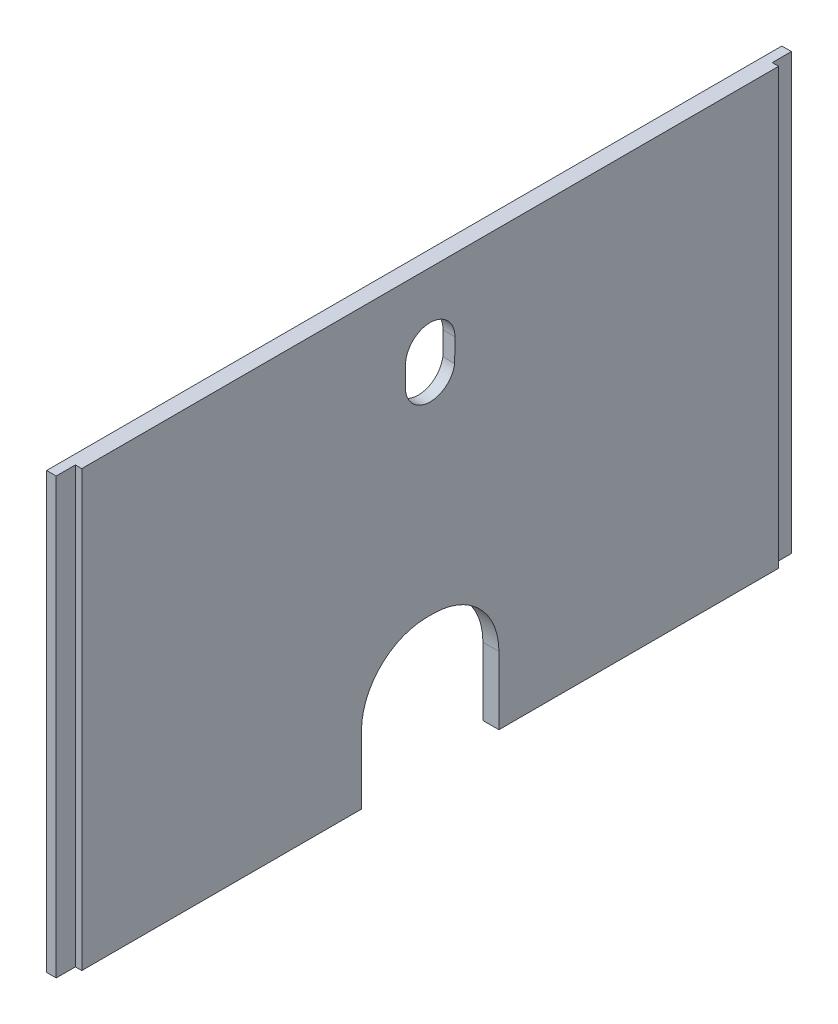
from build123d import *

# Parameters (mm, degrees)
SKETCH_1_W           = 120
SKETCH_1_H           = 68
EXTRUDE_1_DEPTH      = 3
CUT_EXTRUDE_1_DEPTH  = 91.735880444
CUT_EXTRUDE_7_DEPTH  = 2.5
CUT_EXTRUDE_10_DEPTH = 2.5
SKETCH_17_W          = 9
SKETCH_17_H          = 12
CUT_EXTRUDE_11_DEPTH = 0.65
EXTRUDE_2_DEPTH      = 8
SKETCH_19_W          = 1.564505321
SKETCH_19_H          = 29.5
CUT_EXTRUDE_12_DEPTH = 8
EXTRUDE_3_DEPTH      = 3


with BuildPart() as part:
    # 스케치1 → 보스-돌출1 (new body)
    with BuildSketch(Plane(origin=(0, 0, 0), x_dir=(0, 0, -1), z_dir=(1, 0, 0))):
        Rectangle(SKETCH_1_W, SKETCH_1_H)
    extrude(amount=EXTRUDE_1_DEPTH)

    # 스케치2 → 컷-돌출1 (cut, through all)
    with BuildSketch(Plane(origin=(0, 34, 0), x_dir=(1, 0, 0), z_dir=(0, 1, 0))):
        Polygon((0.5, -60), (0.5, -57.5), (0.5, 0), (0, 0), (0, -60), align=None)
        Polygon((2, -57.5), (0.5, -57.5), (0.5, -60), (3, -60), (3, -54.5), (2, -54.5), align=None)
        Polygon((0.5, 60), (0.5, 57.5), (2, 57.5), (2, 54.5), (3, 54.5), (3, 60), align=None)
        Polygon((0, 0), (0.5, 0), (0.5, 57.5), (0.5, 60), (0, 60), align=None)
    extrude(amount=-CUT_EXTRUDE_1_DEPTH, mode=Mode.SUBTRACT)

    # 스케치7 → 컷-돌출7 (cut)
    with BuildSketch(Plane(origin=(3, 0, 0), x_dir=(0, 0, -1), z_dir=(1, 0, 0))):
        with BuildLine():
            Line((0.5, -13.133811576), (-0.5, -13.133811576))
            ThreePointArc((-0.5, -13.133811576), (-7.747844507, -16.135967068), (-10.75, -23.383811576))
            Line((-10.75, -23.383811576), (-10.75, -34))
            Line((-10.75, -34), (10.75, -34))
            Line((10.75, -34), (10.75, -23.383811576))
            ThreePointArc((10.75, -23.383811576), (7.747844507, -16.135967068), (0.5, -13.133811576))
        make_face()
    extrude(amount=-CUT_EXTRUDE_7_DEPTH, mode=Mode.SUBTRACT)

    # 스케치16 → 컷-돌출10 (cut)
    with BuildSketch(Plane(origin=(3, 0, 0), x_dir=(0, 0, -1), z_dir=(1, 0, 0))):
        with BuildLine():
            Line((-3.875, 22.666188424), (-3.82691794, 19.057645835))
            ThreePointArc((-3.82691794, 19.057645835), (0, 15.791188424), (3.82691794, 19.057645835))
            Line((3.82691794, 19.057645835), (3.875, 22.666188424))
            ThreePointArc((3.875, 22.666188424), (0, 26.541188424), (-3.875, 22.666188424))
        make_face()
    extrude(amount=-CUT_EXTRUDE_10_DEPTH, mode=Mode.SUBTRACT)

    # 스케치17 → 컷-돌출11 (cut)
    with BuildSketch(Plane.ZY.offset(-0.5)):
        with Locations((0, 20.55)):
            Rectangle(SKETCH_17_W, SKETCH_17_H)
    extrude(amount=-CUT_EXTRUDE_11_DEPTH, mode=Mode.SUBTRACT)

    # 스케치18 → 보스-돌출2 (add)
    with BuildSketch(Plane.ZY.offset(-0.5)):
        Polygon((-12.5, 4.5), (-14.75, 4.5), (-14.75, 2.5), (0, 2.5), (0, 4.5), align=None)
        Polygon((12.5, 4.5), (0, 4.5), (0, 2.5), (14.75, 2.5), (14.75, 4.5), align=None)
    extrude(amount=EXTRUDE_2_DEPTH)

    # 스케치19 → 컷-돌출12 (cut)
    with BuildSketch(Plane(origin=(0, 4.5, 0), x_dir=(1, 0, 0), z_dir=(0, 1, 0))):
        with Locations((-6.71774734, 0)):
            Rectangle(SKETCH_19_W, SKETCH_19_H)
    extrude(amount=-CUT_EXTRUDE_12_DEPTH, mode=Mode.SUBTRACT)

    # 스케치19<3> → 보스-돌출3 (add)
    with BuildSketch(Plane(origin=(0, 4.5, 0), x_dir=(1, 0, 0), z_dir=(0, 1, 0))):
        Polygon((0.5, 6), (0.5, 14.75), (-5.935494679, 14.75), (-5.935494679, -14.75), (0.5, -14.75), (0.5, -5), (-1.935494679, -5), (-1.935494679, -13), (-3.935494679, -13), (-3.935494679, 13), (-1.935494679, 13), (-1.935494679, 6), align=None)
    extrude(amount=EXTRUDE_3_DEPTH)


solid = part.part
